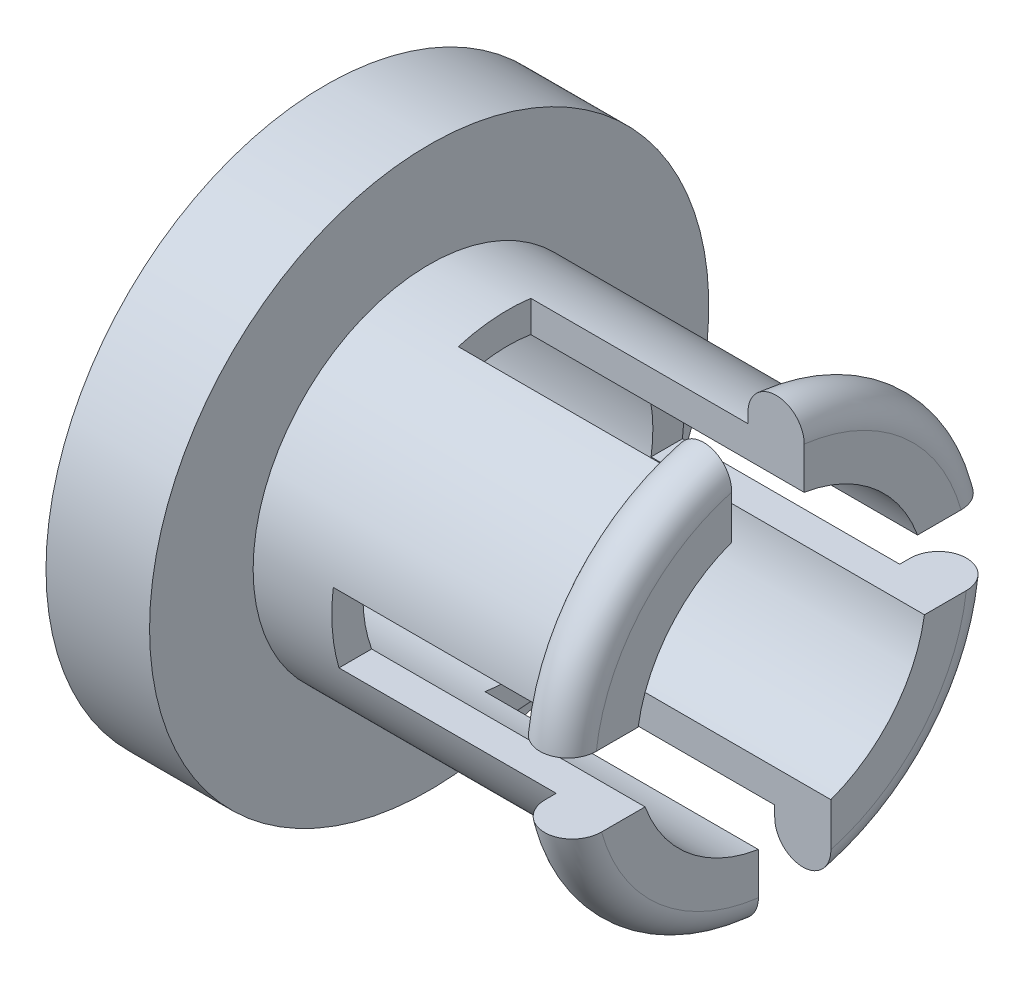
from build123d import *

# Parameters (mm, degrees)
SKETCH2_R          = 4.445
CUT_EXTRUDE1_DEPTH = 18.034
SKETCH5_W          = 8.382
SKETCH5_H          = 2.2225
CUT_EXTRUDE2_DEPTH = 19.496929813
CIRPATTERN1_COUNT  = 4


with BuildPart() as part:
    # Sketch1 → Revolve1 (revolve)
    with BuildSketch(Plane.XY, mode=Mode.PRIVATE) as revolve1_sk:
        with BuildLine():
            Line((0, 0), (13.97, 0))
            Line((13.97, 0), (13.97, 5.715))
            ThreePointArc((13.97, 5.715), (13.109377289, 6.575622711), (12.248754579, 5.715))
            Line((12.248754579, 5.715), (12.248754579, 5.3975))
            Line((12.248754579, 5.3975), (3.175, 5.3975))
            Line((3.175, 5.3975), (3.175, 8.5725))
            Line((3.175, 8.5725), (0, 8.5725))
            Line((0, 8.5725), (0, 0))
        make_face()
    revolve(revolve1_sk.sketch.rotate(Axis((0, 0, 0), (1, 0, 0)), 90), axis=Axis((0, 0, 0), (1, 0, 0)))

    # Sketch2 → Cut-Extrude1 (cut)
    with BuildSketch(Plane.ZY):
        Circle(SKETCH2_R)
    extrude(amount=-CUT_EXTRUDE1_DEPTH, mode=Mode.SUBTRACT)

    # Sketch5 → Cut-Extrude2 (cut, through all)
    with BuildSketch(Plane.XY):
        with Locations((9.779, 0.408848188)):
            Rectangle(SKETCH5_W, SKETCH5_H)
    cut_extrude2 = extrude(amount=-CUT_EXTRUDE2_DEPTH, mode=Mode.SUBTRACT)

    # CirPattern1: Cut-Extrude2 ×4 about axis
    cirpattern1_axis = Axis((0, 0, 0), (1, 0, 0))
    for i in range(1, CIRPATTERN1_COUNT):
        add(cut_extrude2.rotate(cirpattern1_axis, i * 360 / CIRPATTERN1_COUNT), mode=Mode.SUBTRACT)


solid = part.part
